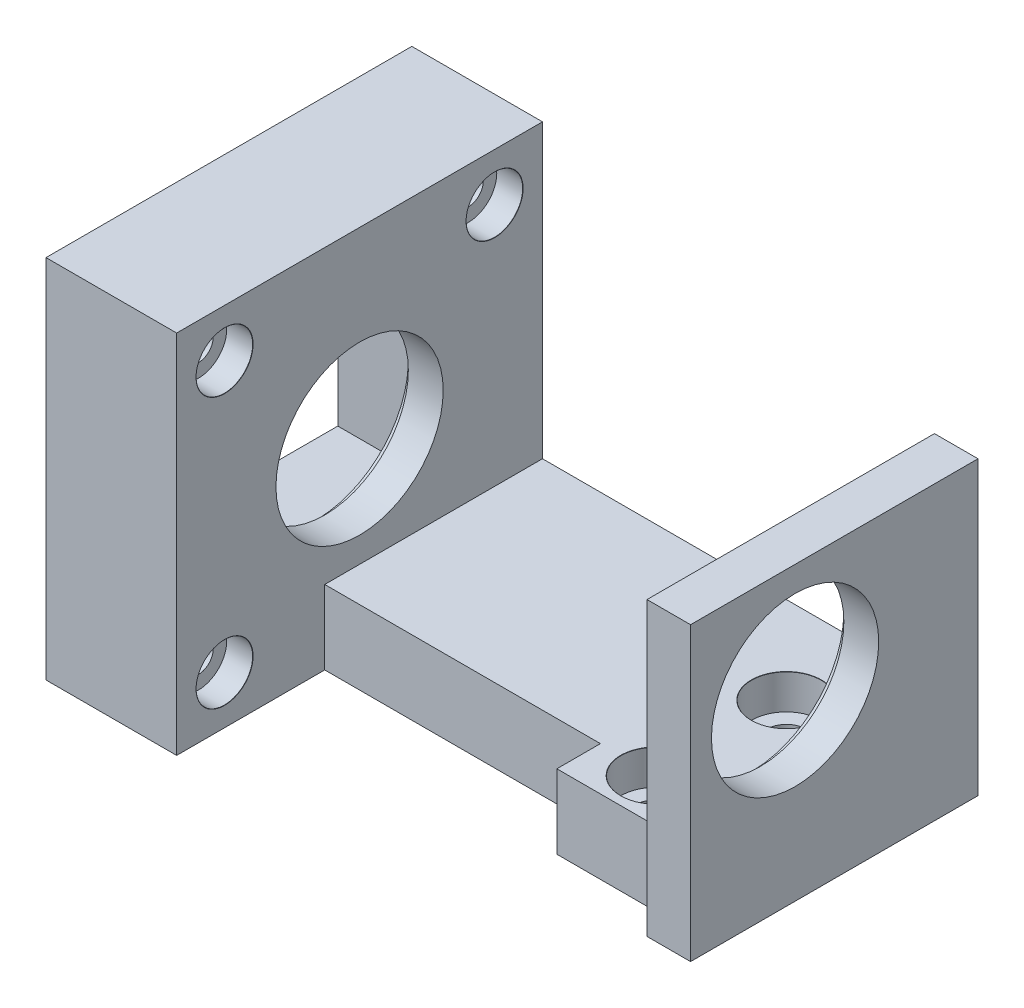
from build123d import *

# Parameters (mm, degrees)
SKETCH1_W                     = 55
SKETCH1_H                     = 33
BOSS_EXTRUDE1_DEPTH           = 5
SKETCH2_W                     = 5
SKETCH2_H                     = 24
BOSS_EXTRUDE2_DEPTH           = 25
HOLE1_D                       = 19.2
HOLE1_DEPTH                   = 5
HOLE1_CBORE_D                 = 21.2
HOLE1_CBORE_DEPTH             = 1
HOLE2_D                       = 19.2
HOLE2_DEPTH                   = 5
HOLE2_CBORE_D                 = 21.2
HOLE2_CBORE_DEPTH             = 1
BOSS_EXTRUDE3_DEPTH           = 5
SKETCH13_W                    = 42
SKETCH13_H                    = 42
SKETCH13_W_2                  = 25
SKETCH13_H_2                  = 25
BOSS_EXTRUDE4_DEPTH           = 10
CBORE_FOR_M3_SHCS3_AT_2_COUNT = 2
CBORE_FOR_M3_SHCS3_AT_2_PITCH = 31
CBORE_FOR_M3_SHCS3_AT_3_COUNT = 2
CBORE_FOR_M3_SHCS3_AT_3_PITCH = 43.840620434
SKETCH23_W                    = 50
SKETCH23_H                    = 33
BOSS_EXTRUDE6_DEPTH           = 3.5
CBORE_FOR_M4_SHCS1_AT_2_COUNT = 2
CBORE_FOR_M4_SHCS1_AT_2_PITCH = 15
CUT_EXTRUDE3_DEPTH            = 57.380404397
SKETCH24_W                    = 5
SKETCH24_H                    = 9
BOSS_EXTRUDE7_DEPTH           = 25


with BuildPart() as part:
    # Sketch1 → Boss-Extrude1 (new body)
    with BuildSketch(Plane(origin=(0, 0, 0), x_dir=(1, 0, 0), z_dir=(0, 1, 0))):
        Rectangle(SKETCH1_W, SKETCH1_H)
    extrude(amount=BOSS_EXTRUDE1_DEPTH)

    # Sketch2 → Boss-Extrude2 (add)
    with BuildSketch(Plane(origin=(0, 5, 0), x_dir=(1, 0, 0), z_dir=(0, 1, 0))):
        with Locations((-25, -4.5)):
            Rectangle(SKETCH2_W, SKETCH2_H)
        with Locations((25, -4.5)):
            Rectangle(SKETCH2_W, SKETCH2_H)
    extrude(amount=BOSS_EXTRUDE2_DEPTH)

    # Hole1
    with Locations(Plane(origin=(-27.5, 0, 0), x_dir=(0, 0, -1), z_dir=(-1, 0, 0))):
        with Locations((-4.5, -17.5)):
            CounterBoreHole(HOLE1_D / 2, HOLE1_CBORE_D / 2, HOLE1_CBORE_DEPTH, depth=HOLE1_DEPTH)

    # Hole2
    with Locations(Plane(origin=(22.5, 0, 0), x_dir=(0, 0, -1), z_dir=(-1, 0, 0))):
        with Locations((-4.5, -17.5)):
            CounterBoreHole(HOLE2_D / 2, HOLE2_CBORE_D / 2, HOLE2_CBORE_DEPTH, depth=HOLE2_DEPTH)

    # Sketch12 → Boss-Extrude3 (add)
    with BuildSketch(Plane.ZY.offset(27.5)):
        Polygon((-16.5, 38.5), (25.5, 38.5), (25.5, -3.5), (-16.5, -3.5), (-16.5, 0), (16.5, 0), (16.5, 30), (-7.5, 30), (-7.5, 5), (-16.5, 5), align=None)
    extrude(amount=-BOSS_EXTRUDE3_DEPTH)

    # Sketch13 → Boss-Extrude4 (add)
    with BuildSketch(Plane.ZY.offset(27.5)):
        with Locations((4.5, 17.5)):
            Rectangle(SKETCH13_W, SKETCH13_H)
        with Locations((4.5, 17.5)):
            Rectangle(SKETCH13_W_2, SKETCH13_H_2, mode=Mode.SUBTRACT)
    extrude(amount=BOSS_EXTRUDE4_DEPTH)

    # Sketch15 → CBORE for M3 SHCS3 (revolve, cut)
    with BuildSketch(Plane(origin=(-22.5, 2, 20), x_dir=(0, 0, -1), z_dir=(0, 1, 0))):
        Polygon((0, 0), (0, 15), (1.7, 15), (1.7, 3), (3.25, 3), (3.25, 0.020977491), (3.275, 0), align=None)
    cbore_for_m3_shcs3 = revolve(axis=Axis((-16.15, 2, 20), (-1, 0, 0)), mode=Mode.SUBTRACT)

    # CBORE for M3 SHCS3 at 2: CBORE for M3 SHCS3 ×2
    with Locations(*[(0, i * CBORE_FOR_M3_SHCS3_AT_2_PITCH, 0) for i in range(1, CBORE_FOR_M3_SHCS3_AT_2_COUNT)]):
        add(cbore_for_m3_shcs3, mode=Mode.SUBTRACT)

    # CBORE for M3 SHCS3 at 3: CBORE for M3 SHCS3 ×2
    with Locations(*[Vector(0, 0.7071067811865476, -0.7071067811865476) * (i * CBORE_FOR_M3_SHCS3_AT_3_PITCH) for i in range(1, CBORE_FOR_M3_SHCS3_AT_3_COUNT)]):
        add(cbore_for_m3_shcs3, mode=Mode.SUBTRACT)

    # Sketch23 → Boss-Extrude6 (add)
    with BuildSketch(Plane.XZ):
        with Locations((2.5, 0)):
            Rectangle(SKETCH23_W, SKETCH23_H)
    extrude(amount=BOSS_EXTRUDE6_DEPTH)

    # Sketch10 → CBORE for M4 SHCS1 (revolve, cut)
    with BuildSketch(Plane(origin=(15.5, 5, -6.5), x_dir=(0, 0, 1), z_dir=(1, 0, 0))):
        Polygon((0, 0), (0, 8.5), (2.25, 8.5), (2.25, 4), (4, 4), (4, 0.020977491), (4.025, 0), align=None)
    cbore_for_m4_shcs1 = revolve(axis=Axis((15.5, 11.35, -6.5), (0, -1, 0)), mode=Mode.SUBTRACT)

    # CBORE for M4 SHCS1 at 2: CBORE for M4 SHCS1 ×2
    with Locations(*[(0, 0, i * CBORE_FOR_M4_SHCS1_AT_2_PITCH) for i in range(1, CBORE_FOR_M4_SHCS1_AT_2_COUNT)]):
        add(cbore_for_m4_shcs1, mode=Mode.SUBTRACT)

    # Sketch21 → Cut-Extrude3 (cut, through all)
    with BuildSketch(Plane(origin=(0, 5, 0), x_dir=(1, 0, 0), z_dir=(0, 1, 0))):
        Polygon((-22.5, -16.5), (-22.5, -8.5), (9.15, -8.5), (9.15, -13.5), (22.5, -13.5), (22.5, -16.5), align=None)
    extrude(amount=-CUT_EXTRUDE3_DEPTH, mode=Mode.SUBTRACT)

    # Sketch24 → Boss-Extrude7 (add)
    with BuildSketch(Plane(origin=(0, 5, 0), x_dir=(1, 0, 0), z_dir=(0, 1, 0))):
        with Locations((25, 12)):
            Rectangle(SKETCH24_W, SKETCH24_H)
    extrude(amount=BOSS_EXTRUDE7_DEPTH)


solid = part.part
